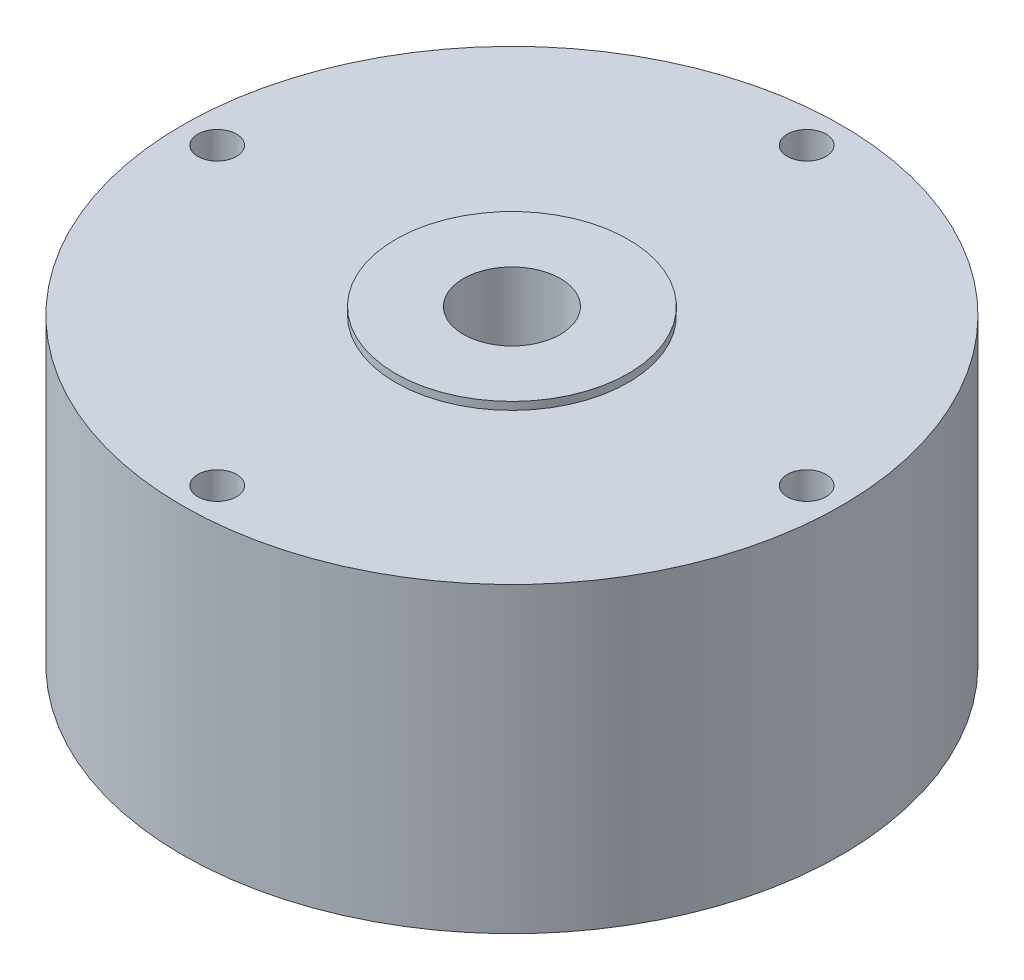
from build123d import *

# Parameters (mm, degrees)
SKETCH1_R      = 17
EXTRUDE1_DEPTH = 16
EXTRUDE2_START = -0.4
SKETCH2_R      = 17
SKETCH2_R_2    = 6
EXTRUDE2_DEPTH = 0.4
SKETCH3_R      = 1
EXTRUDE3_DEPTH = 3.4
SKETCH5_R      = 1.25
EXTRUDE5_DEPTH = 3
SKETCH6_R      = 2.5
EXTRUDE6_DEPTH = 29.879058156


with BuildPart() as part:
    # Sketch1 → Extrude1 (new body)
    with BuildSketch(Plane(origin=(0, 0, 0), x_dir=(1, 0, 0), z_dir=(0, 1, 0))):
        Circle(SKETCH1_R)
    extrude(amount=EXTRUDE1_DEPTH)

    # Sketch2 → Extrude2 (cut)
    with BuildSketch(Plane(origin=(0, 16, 0), x_dir=(1, 0, 0), z_dir=(0, 1, 0)).offset(EXTRUDE2_START)):
        Circle(SKETCH2_R)
        Circle(SKETCH2_R_2, mode=Mode.SUBTRACT)
    extrude(amount=EXTRUDE2_DEPTH, mode=Mode.SUBTRACT)

    # Sketch3 → Extrude3 (cut)
    with BuildSketch(Plane(origin=(0, 16, 0), x_dir=(1, 0, 0), z_dir=(0, 1, 0))):
        with Locations((0, 15.2028)):
            Circle(SKETCH3_R)
        with Locations((15.2028, 0)):
            Circle(SKETCH3_R)
        with Locations((0, -15.2028)):
            Circle(SKETCH3_R)
        with Locations((-15.2028, 0)):
            Circle(SKETCH3_R)
    extrude(amount=-EXTRUDE3_DEPTH, mode=Mode.SUBTRACT)

    # Sketch5 → Extrude5 (cut)
    with BuildSketch(Plane.XZ):
        with Locations((-11, 6)):
            Circle(SKETCH5_R)
        with Locations((11, 6)):
            Circle(SKETCH5_R)
        with Locations((11, -6)):
            Circle(SKETCH5_R)
        with Locations((-11, -6)):
            Circle(SKETCH5_R)
    extrude(amount=-EXTRUDE5_DEPTH, mode=Mode.SUBTRACT)

    # Sketch6 → Extrude6 (cut, through all)
    with BuildSketch(Plane.XZ):
        Circle(SKETCH6_R)
    extrude(amount=-EXTRUDE6_DEPTH, mode=Mode.SUBTRACT)


solid = part.part
